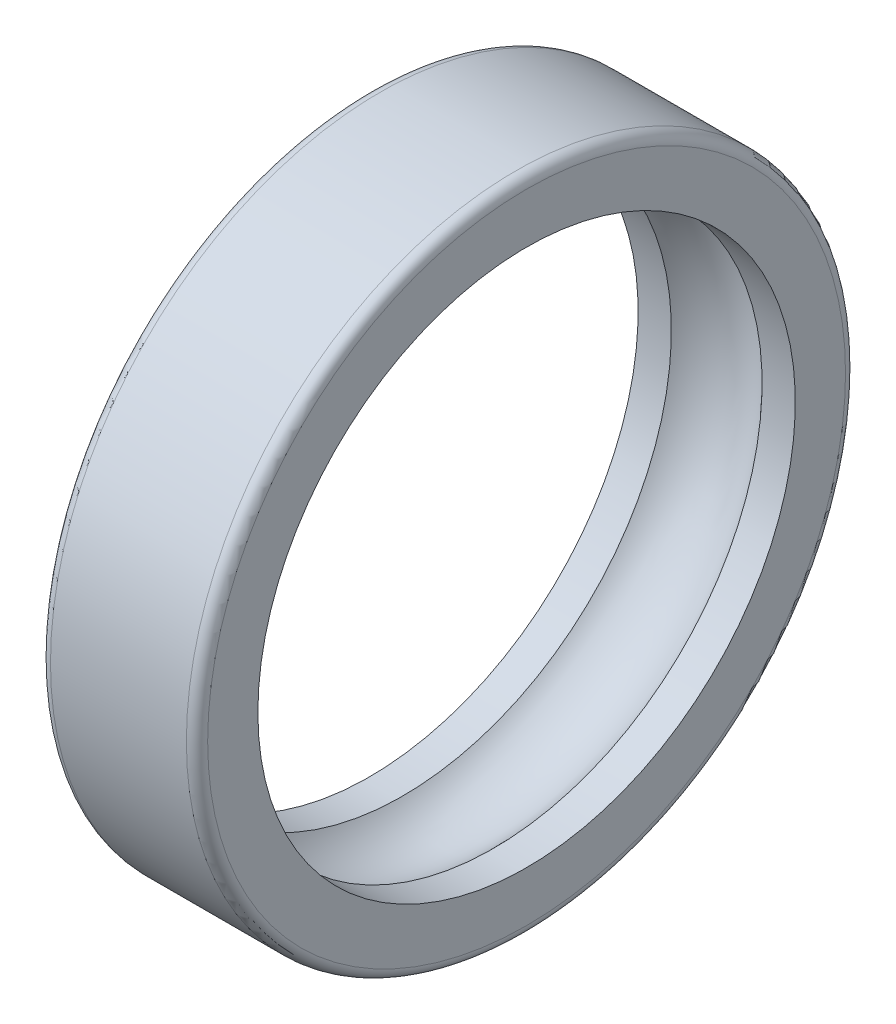
from build123d import *

# Parameters (mm, degrees)
FILLET1_R = 2.1


with BuildPart() as part:
    # Sketch1 → Revolve1 (revolve)
    with BuildSketch(Plane.XY, mode=Mode.PRIVATE) as revolve1_sk:
        with BuildLine():
            Line((-15.5, 53), (-8.94427191, 53))
            ThreePointArc((-8.94427191, 53), (0, 57), (8.94427191, 53))
            Line((8.94427191, 53), (15.5, 53))
            Line((15.5, 53), (15.5, 65))
            Line((15.5, 65), (-15.5, 65))
            Line((-15.5, 65), (-15.5, 53))
        make_face()
    revolve(revolve1_sk.sketch.rotate(Axis((-15.531958763, 0, 0), (1, 0, 0)), 90), axis=Axis((-15.531958763, 0, 0), (1, 0, 0)))

    # Fillet1
    fillet1_edges = [part.edges().sort_by_distance(p)[0] for p in [
        (15.5, 0, -65),
        (-15.5, 0, -65),
    ]]
    fillet(fillet1_edges, radius=FILLET1_R)


solid = part.part
